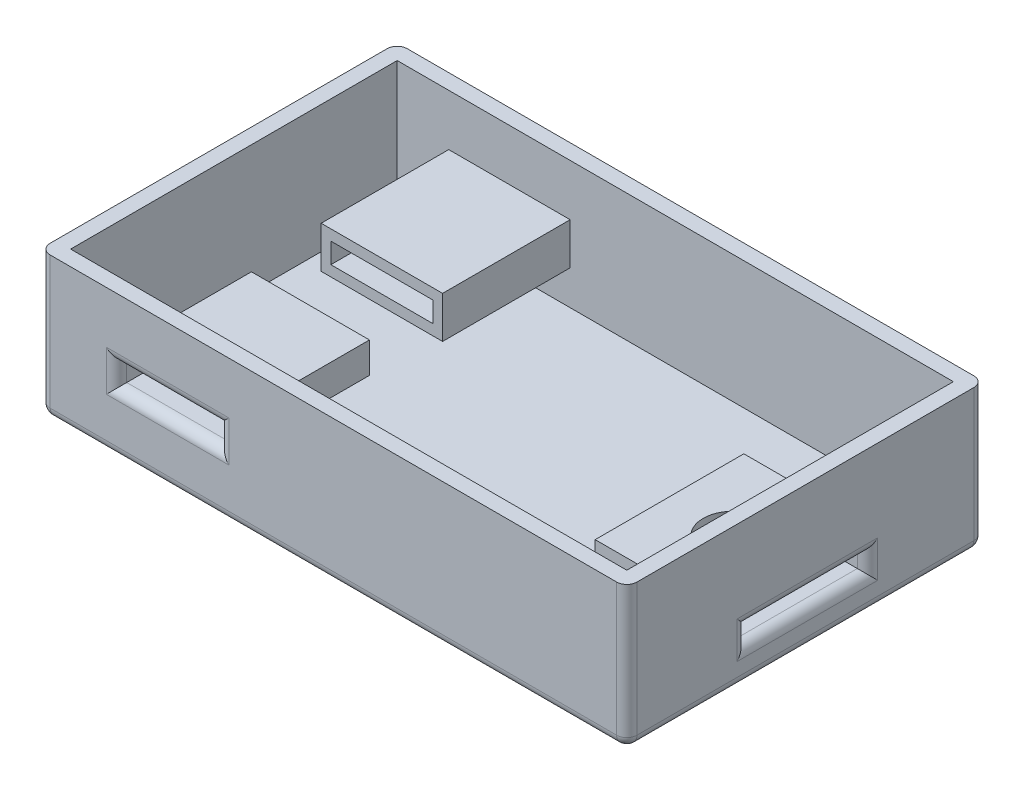
from build123d import *

# Parameters (mm, degrees)
SKETCH1_W           = 115
SKETCH1_H           = 70
BOSS_EXTRUDE1_DEPTH = 28
SHELL2_T            = -3
SKETCH2_W           = 20
SKETCH2_H           = 4
CUT_EXTRUDE1_DEPTH  = 95.816928868
SKETCH4_W           = 23.796796
SKETCH4_H           = 8.165514589
SKETCH4_W_2         = 20
SKETCH4_H_2         = 4
BOSS_EXTRUDE2_DEPTH = 25
SKETCH5_W           = 23.125103044
SKETCH5_H           = 6.017817829
SKETCH5_W_2         = 20
SKETCH5_H_2         = 4
BOSS_EXTRUDE3_DEPTH = 25
FILLET2_R           = 2
FILLET3_R           = 2
SKETCH9_W           = 29.136235749
SKETCH9_H           = 7.961178331
BOSS_EXTRUDE4_DEPTH = 25
SKETCH11_W          = 23.614359243
SKETCH11_H          = 3.227216001
CUT_EXTRUDE4_DEPTH  = 101.543522914
FILLET4_R           = 2
CUT_EXTRUDE5_REACH  = 71.124
SKETCH12_R          = 5.884599132
SKETCH13_W          = 29.136235749
SKETCH13_H          = 7.961178331
BOSS_EXTRUDE5_DEPTH = 2


with BuildPart() as part:
    # Sketch1 → Boss-Extrude1 (new body)
    with BuildSketch(Plane(origin=(0, 0, 0), x_dir=(1, 0, 0), z_dir=(0, 1, 0))):
        Rectangle(SKETCH1_W, SKETCH1_H)
    extrude(amount=BOSS_EXTRUDE1_DEPTH)

    # Shell2
    shell2_openings = [part.faces().sort_by_distance(p)[0] for p in [
        (0, 28, 0),
    ]]
    offset(amount=SHELL2_T, openings=shell2_openings, kind=Kind.INTERSECTION)

    # Sketch2 → Cut-Extrude1 (cut, through all)
    with BuildSketch(Plane.XY.offset(35)):
        with Locations((-32.5, 13.8542792)):
            Rectangle(SKETCH2_W, SKETCH2_H)
    extrude(amount=-CUT_EXTRUDE1_DEPTH, mode=Mode.SUBTRACT)

    # Sketch4 → Boss-Extrude2 (add)
    with BuildSketch(Plane.XY.offset(-32)):
        with Locations((-32.5, 13.854279201)):
            Rectangle(SKETCH4_W, SKETCH4_H)
        with Locations((-32.5, 13.8542792)):
            Rectangle(SKETCH4_W_2, SKETCH4_H_2, mode=Mode.SUBTRACT)
    extrude(amount=BOSS_EXTRUDE2_DEPTH)

    # Sketch5 → Boss-Extrude3 (add)
    with BuildSketch(Plane(origin=(0, 0, 32), x_dir=(-1, 0, 0), z_dir=(0, 0, -1))):
        with Locations((32.5, 13.854279201)):
            Rectangle(SKETCH5_W, SKETCH5_H)
        with Locations((32.5, 13.8542792)):
            Rectangle(SKETCH5_W_2, SKETCH5_H_2, mode=Mode.SUBTRACT)
    extrude(amount=BOSS_EXTRUDE3_DEPTH)

    # Fillet2
    fillet2_edges = [part.edges().sort_by_distance(p)[0] for p in [
        (0, 0, 35),
        (-57.5, 0, 0),
        (0, 0, -35),
        (57.5, 0, 0),
        (57.5, 14, 35),
        (-57.5, 14, 35),
        (-57.5, 14, -35),
        (57.5, 14, -35),
    ]]
    fillet(fillet2_edges, radius=FILLET2_R)

    # Fillet3
    fillet3_edges = [part.edges().sort_by_distance(p)[0] for p in [
        (-42.5, 13.8542792, -35),
        (-32.5, 15.8542792, -35),
        (-22.5, 13.8542792, -35),
        (-32.5, 11.8542792, -35),
        (-42.5, 13.8542792, 35),
        (-32.5, 11.8542792, 35),
        (-22.5, 13.8542792, 35),
        (-32.5, 15.8542792, 35),
    ]]
    fillet(fillet3_edges, radius=FILLET3_R)

    # Sketch9 → Boss-Extrude4 (add)
    with BuildSketch(Plane.ZY.offset(-57.5)):
        with Locations((-0.368841187, 8.308427345)):
            Rectangle(SKETCH9_W, SKETCH9_H)
    extrude(amount=BOSS_EXTRUDE4_DEPTH)

    # Sketch11 → Cut-Extrude4 (cut, through all)
    with BuildSketch(Plane.ZY.offset(-32.5)):
        with Locations((-0.368841187, 8.308427345)):
            Rectangle(SKETCH11_W, SKETCH11_H)
    extrude(amount=-CUT_EXTRUDE4_DEPTH, mode=Mode.SUBTRACT)

    # Fillet4
    fillet4_edges = [part.edges().sort_by_distance(p)[0] for p in [
        (57.5, 8.308427345, 11.438338435),
        (57.5, 6.694819344, -0.368841187),
        (57.5, 8.308427345, -12.176020808),
        (57.5, 9.922035345, -0.368841187),
    ]]
    fillet(fillet4_edges, radius=FILLET4_R)

    # Sketch12 → Cut-Extrude5 (cut, up to next)
    with BuildSketch(Plane(origin=(0, 12.28901651, 0), x_dir=(1, 0, 0), z_dir=(0, 1, 0)), mode=Mode.PRIVATE) as cut_extrude5_sk1:
        with Locations(Location((43.35506163, 0, 0), (0, 0, 270))):
            Circle(SKETCH12_R)
    cut_extrude5_tool1 = extrude(cut_extrude5_sk1.sketch, amount=-CUT_EXTRUDE5_REACH, mode=Mode.PRIVATE) & part.part
    add(cut_extrude5_tool1.solids().sort_by_distance((43.355062, 12.289017, 0))[0], mode=Mode.SUBTRACT)

    # Sketch13 → Boss-Extrude5 (add)
    with BuildSketch(Plane.ZY.offset(-32.5)):
        with Locations((-0.368841187, 8.308427345)):
            Rectangle(SKETCH13_W, SKETCH13_H)
    extrude(amount=BOSS_EXTRUDE5_DEPTH)


solid = part.part
